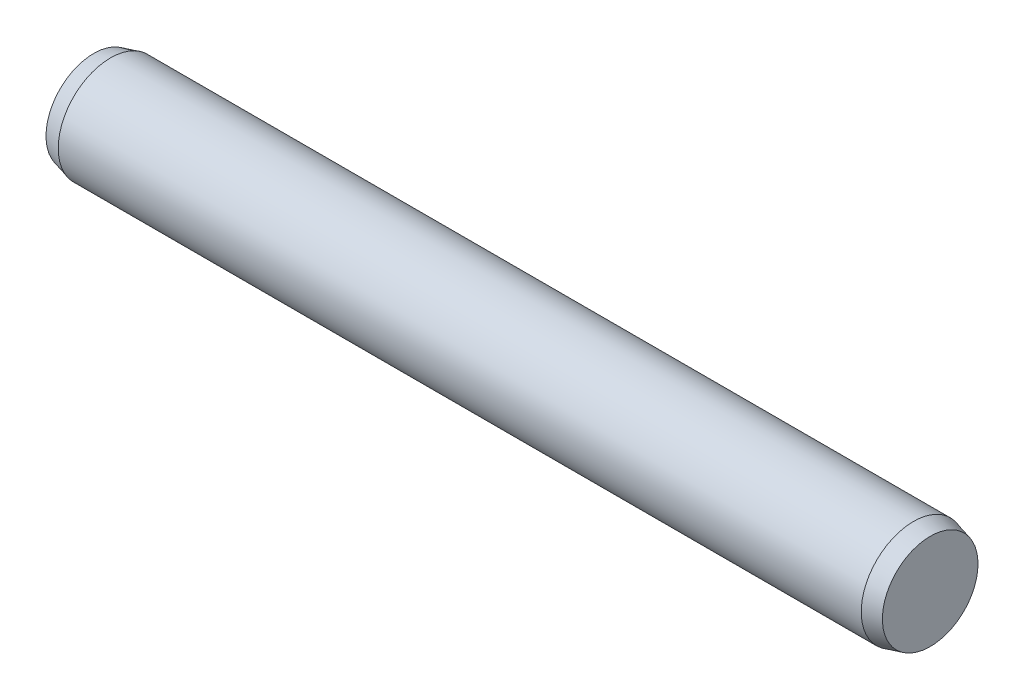
from build123d import *

# Parameters (mm, degrees)
EXTRUDE1_DEPTH      = 19.2
EXTRUDE1_DEPTH_BACK = 19.2
SKETCH2_R           = 2.5
SKETCH3_R           = 2.5
EXTRUDE2_DEPTH      = 0.8
EXTRUDE2_TAPER      = 15
SKETCH4_R           = 2.5
EXTRUDE3_DEPTH      = 0.8
EXTRUDE3_TAPER      = 15


with BuildPart() as part:
    # Sketch2 → Extrude1 (new, two sides: drawn at the far end of the back side and taken through both)
    with BuildSketch(Plane(origin=(0, 0, 0), x_dir=(0, 0, -1), z_dir=(1, 0, 0)).offset(-EXTRUDE1_DEPTH_BACK)):
        Circle(SKETCH2_R)
    extrude(amount=EXTRUDE1_DEPTH + EXTRUDE1_DEPTH_BACK)

    # Sketch3 → Extrude2 (add)
    with BuildSketch(Plane(origin=(19.2, 0, 0), x_dir=(0, 0, -1), z_dir=(1, 0, 0))):
        Circle(SKETCH3_R)
    extrude(amount=EXTRUDE2_DEPTH, taper=EXTRUDE2_TAPER)

    # Sketch4 → Extrude3 (add)
    with BuildSketch(Plane.ZY.offset(19.2)):
        with Locations(Location((0, 0, 0), (0, 0, 180))):
            Circle(SKETCH4_R)
    extrude(amount=EXTRUDE3_DEPTH, taper=EXTRUDE3_TAPER)


solid = part.part
